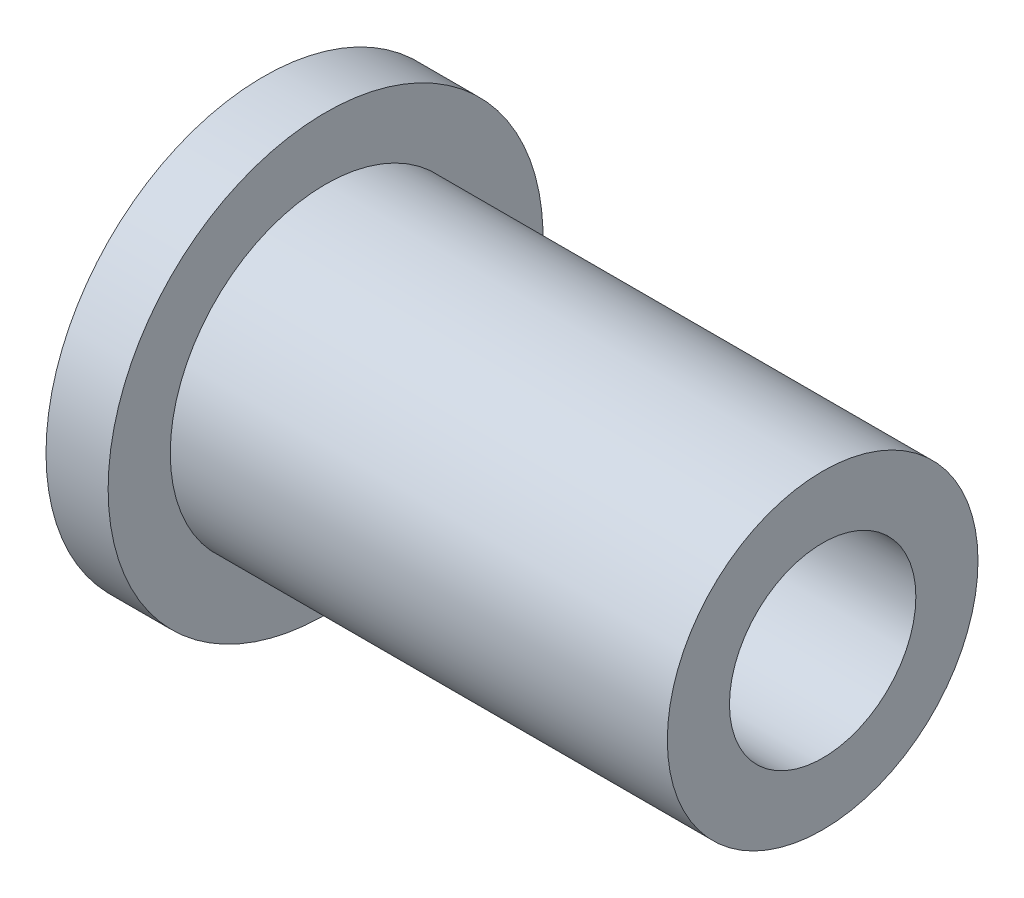
from build123d import *
from build123d.topology import SkipClean

# Parameters (mm, degrees)
SKETCH2_R           = 3.96875
SKETCH2_R_2         = 2.38125
BOSS_EXTRUDE1_DEPTH = 12.7
BOSS_EXTRUDE2_START = 1.5875
SKETCH3_R           = 5.55625
SKETCH3_R_2         = 2.38125
BOSS_EXTRUDE2_DEPTH = 1.5875


with BuildPart() as part:
    # Sketch2 → Boss-Extrude1 (new body)
    with BuildSketch(Plane(origin=(0, 0, 0), x_dir=(0, 0, -1), z_dir=(1, 0, 0))):
        Circle(SKETCH2_R)
        Circle(SKETCH2_R_2, mode=Mode.SUBTRACT)
    extrude(amount=BOSS_EXTRUDE1_DEPTH)

    # Sketch3 → Boss-Extrude2 (add)
    with SkipClean():  # the faces are left unmerged after this step: merging them gives an invalid solid
        with BuildSketch(Plane.ZY.offset(BOSS_EXTRUDE2_START)):
            Circle(SKETCH3_R)
            Circle(SKETCH3_R_2, mode=Mode.SUBTRACT)
        extrude(amount=-BOSS_EXTRUDE2_DEPTH)


solid = part.part
